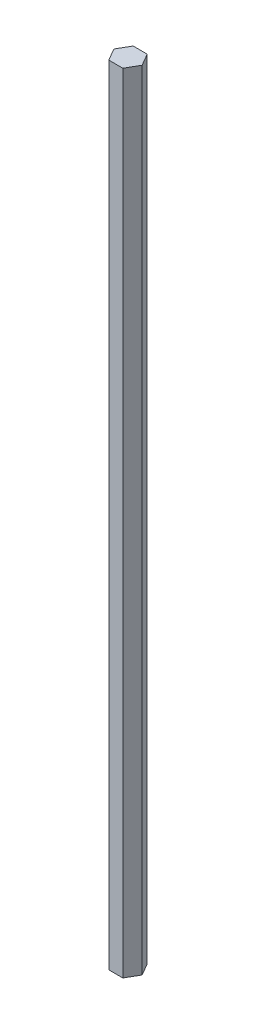
from build123d import *

# Parameters (mm, degrees)
BOSS_EXTRUDE1_DEPTH = 410.464


with BuildPart() as part:
    # Sketch1 → Boss-Extrude1 (new body)
    with BuildSketch(Plane(origin=(0, 0, 0), x_dir=(1, 0, 0), z_dir=(0, 1, 0))):
        Polygon((3.666174209, -6.35), (7.332348419, 0), (3.666174209, 6.35), (-3.666174209, 6.35), (-7.332348419, 0), (-3.666174209, -6.35), align=None)
    extrude(amount=BOSS_EXTRUDE1_DEPTH)


solid = part.part
